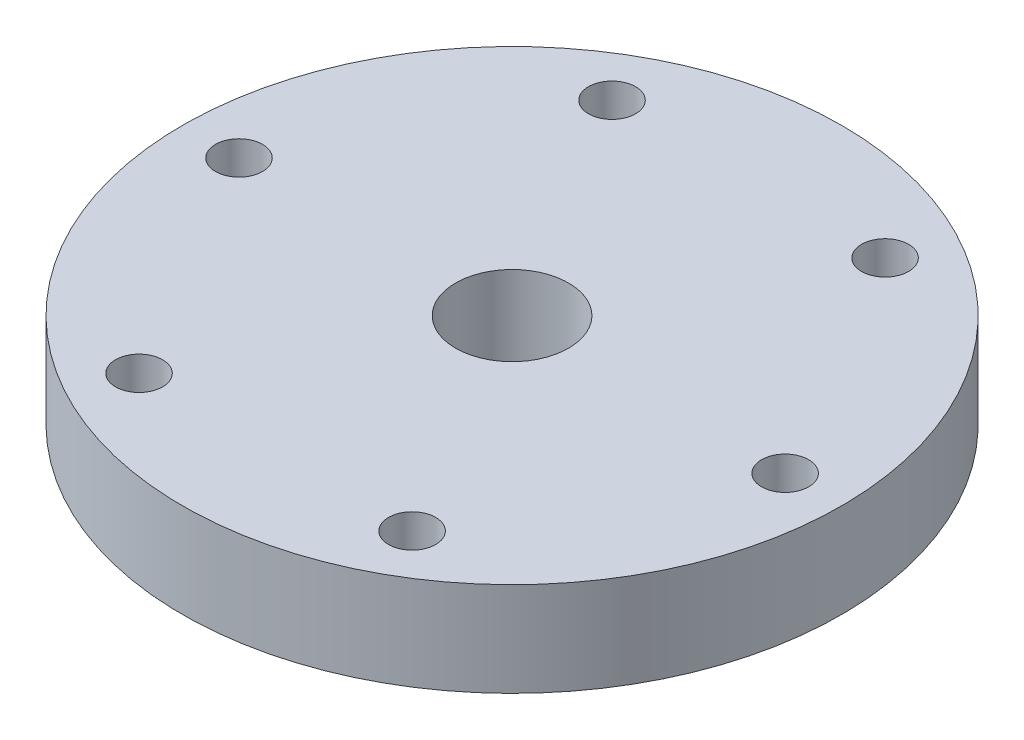
from build123d import *

# Parameters (mm, degrees)
REDONDEO1_R            = 2
TALADRO_ROSCADO_M61_D  = 5
TALADRO_ROSCADO_M141_D = 12
MATRIZC1_COUNT         = 6


with BuildPart() as part:
    # Croquis1 → Revolución1 (revolve)
    with BuildSketch(Plane.XY, mode=Mode.PRIVATE) as revoluci_n1_sk:
        Polygon((2, 0), (2, 15), (35, 15), (35, 5), (15, 5), (15, 0), align=None)
    revolve(revoluci_n1_sk.sketch.rotate(Axis((0, 0, 0), (0, 1, 0)), 90), axis=Axis((0, 0, 0), (0, 1, 0)))

    # Redondeo1
    redondeo1_edges = [part.edges().sort_by_distance(p)[0] for p in [
        (0, 5, 15),
    ]]
    fillet(redondeo1_edges, radius=REDONDEO1_R)

    # Taladro roscado M61 (through all)
    with Locations(Plane(origin=(0, 15, 0), x_dir=(1, 0, 0), z_dir=(0, 1, 0))):
        with Locations((29, 0)):
            taladro_roscado_m61 = Hole(TALADRO_ROSCADO_M61_D / 2)

    # Taladro roscado M141 (through all)
    with Locations(Plane(origin=(0, 15, 0), x_dir=(1, 0, 0), z_dir=(0, 1, 0))):
        with Locations((0, 0)):
            Hole(TALADRO_ROSCADO_M141_D / 2)

    # MatrizC1: Taladro roscado M61 ×6 about axis
    matrizc1_axis = Axis((0, 0, 0), (0, 1, 0))
    for i in range(1, MATRIZC1_COUNT):
        add(taladro_roscado_m61.rotate(matrizc1_axis, i * 360 / MATRIZC1_COUNT), mode=Mode.SUBTRACT)


solid = part.part
